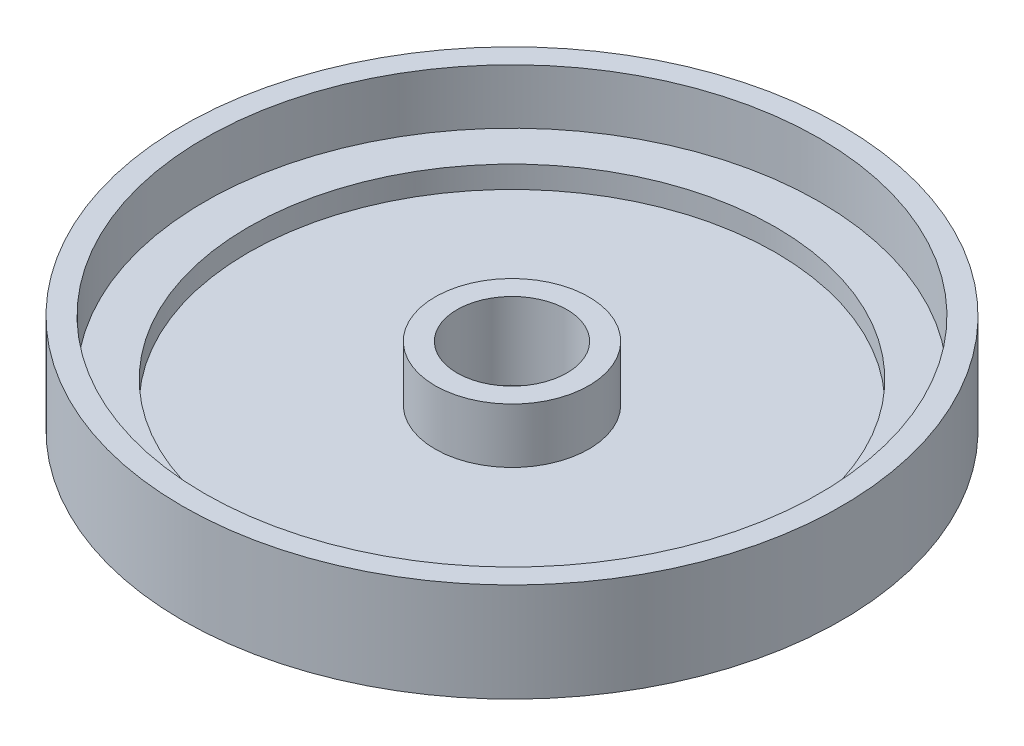
from build123d import *

# Parameters (mm, degrees)
SKETCH1_R           = 38.1
SKETCH1_R_2         = 6.35
BOSS_EXTRUDE1_DEPTH = 2.54
SKETCH2_R           = 8.89
SKETCH2_R_2         = 6.35
BOSS_EXTRUDE2_DEPTH = 6.35
SKETCH5_R           = 38.1
SKETCH5_R_2         = 30.48
BOSS_EXTRUDE3_DEPTH = 2.54
SKETCH6_R           = 38.1
SKETCH6_R_2         = 35.56
BOSS_EXTRUDE4_DEPTH = 6.35


with BuildPart() as part:
    # Sketch1 → Boss-Extrude1 (new body)
    with BuildSketch(Plane(origin=(0, 0, 0), x_dir=(1, 0, 0), z_dir=(0, 1, 0))):
        with Locations(Location((0, 0, 0), (0, 0, 270))):
            Circle(SKETCH1_R)
        with Locations(Location((0, 0, 0), (0, 0, 270))):
            Circle(SKETCH1_R_2, mode=Mode.SUBTRACT)
    extrude(amount=BOSS_EXTRUDE1_DEPTH)

    # Sketch2 → Boss-Extrude2 (add)
    with BuildSketch(Plane(origin=(0, 2.54, 0), x_dir=(1, 0, 0), z_dir=(0, 1, 0))):
        with Locations(Location((0, 0, 0), (0, 0, 270))):
            Circle(SKETCH2_R)
        with Locations(Location((0, 0, 0), (0, 0, 270))):
            Circle(SKETCH2_R_2, mode=Mode.SUBTRACT)
    extrude(amount=BOSS_EXTRUDE2_DEPTH)

    # Sketch5 → Boss-Extrude3 (add)
    with BuildSketch(Plane(origin=(0, 2.54, 0), x_dir=(1, 0, 0), z_dir=(0, 1, 0))):
        with Locations(Location((0, 0, 0), (0, 0, 270))):
            Circle(SKETCH5_R)
        with Locations(Location((0, 0, 0), (0, 0, 270))):
            Circle(SKETCH5_R_2, mode=Mode.SUBTRACT)
    extrude(amount=BOSS_EXTRUDE3_DEPTH)

    # Sketch6 → Boss-Extrude4 (add)
    with BuildSketch(Plane(origin=(0, 5.08, 0), x_dir=(1, 0, 0), z_dir=(0, 1, 0))):
        with Locations(Location((0, 0, 0), (0, 0, 270))):
            Circle(SKETCH6_R)
        with Locations(Location((0, 0, 0), (0, 0, 270))):
            Circle(SKETCH6_R_2, mode=Mode.SUBTRACT)
    extrude(amount=BOSS_EXTRUDE4_DEPTH)


solid = part.part
